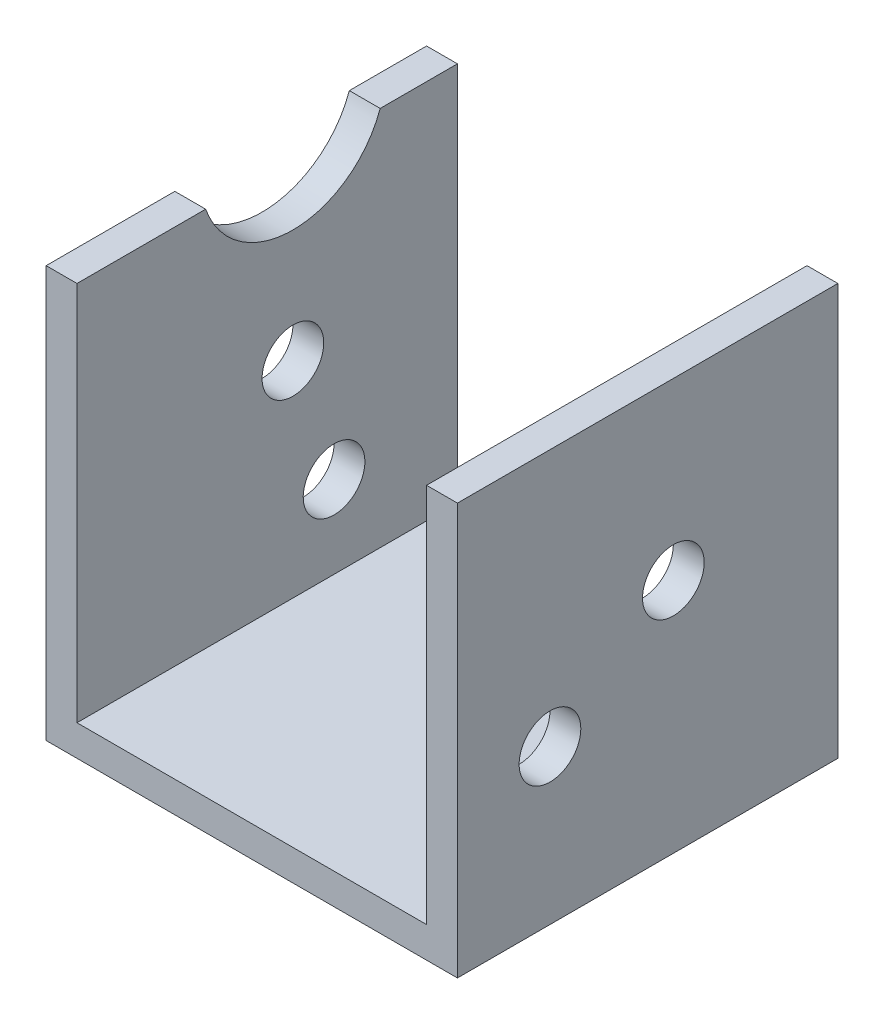
from build123d import *

# Parameters (mm, degrees)
EXTRUSION1_DEPTH = 18.5
ESQUISSE2_R      = 1.5
EXTRUSION2_DEPTH = 5
ESQUISSE3_R      = 4.5
ESQUISSE3_R_2    = 1.5
EXTRUSION3_DEPTH = 5
ESQUISSE4_R      = 1.5
EXTRUSION4_DEPTH = 34.008102077


with BuildPart() as part:
    # Esquisse1 → Extrusion1 (new body)
    with BuildSketch(Plane.XY):
        Polygon((-16.636265327, 18.635578947), (-16.636265327, -1.364421053), (3.363734673, -1.364421053), (3.363734673, 18.635578947), (1.863734673, 18.635578947), (1.863734673, 0.135578947), (-15.136265327, 0.135578947), (-15.136265327, 18.635578947), align=None)
    extrude(amount=EXTRUSION1_DEPTH)

    # Esquisse2 → Extrusion2 (cut)
    with BuildSketch(Plane(origin=(3.363734673, 0, 0), x_dir=(0, 0, -1), z_dir=(1, 0, 0))):
        with Locations((-14, 6.135578947)):
            Circle(ESQUISSE2_R)
    extrude(amount=-EXTRUSION2_DEPTH, mode=Mode.SUBTRACT)

    # Esquisse3 → Extrusion3 (cut)
    with BuildSketch(Plane.ZY.offset(16.636265327)):
        with Locations((8, 20.135578947)):
            Circle(ESQUISSE3_R)
        with Locations(Location((6, 4.135578947, 0), (0, 0, 270))):
            Circle(ESQUISSE3_R_2)
    extrude(amount=-EXTRUSION3_DEPTH, mode=Mode.SUBTRACT)

    # Esquisse4 → Extrusion4 (cut, through all)
    with BuildSketch(Plane.ZY.offset(16.636265327)):
        with Locations(Location((8, 10.135578947, 0), (0, 0, 270))):
            Circle(ESQUISSE4_R)
    extrude(amount=-EXTRUSION4_DEPTH, mode=Mode.SUBTRACT)


solid = part.part
